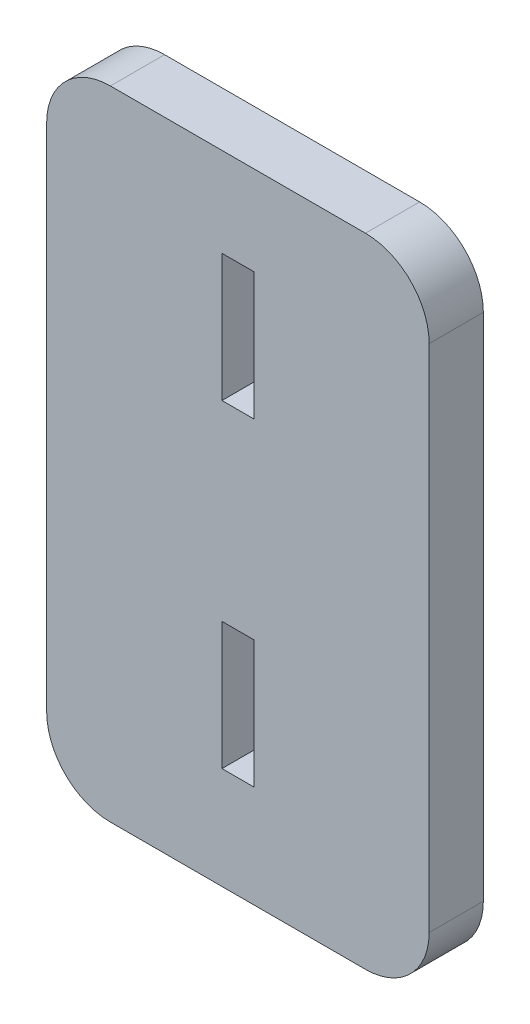
from build123d import *

# Parameters (mm, degrees)
CROQUIS2_W              = 60
CROQUIS2_H              = 100
SALIENTE_EXTRUIR1_DEPTH = 8.5
CROQUIS4_W              = 5
CROQUIS4_H              = 20
CORTAR_EXTRUIR1_DEPTH   = 7.48
REDONDEO1_R             = 10
REDONDEO2_R             = 10


with BuildPart() as part:
    # Croquis2 → Saliente-Extruir1 (new body)
    with BuildSketch(Plane.XY):
        Rectangle(CROQUIS2_W, CROQUIS2_H)
    extrude(amount=SALIENTE_EXTRUIR1_DEPTH)

    # Croquis4 → Cortar-Extruir1 (cut)
    with BuildSketch(Plane.XY.offset(8.5)):
        with Locations((0, 26.02)):
            Rectangle(CROQUIS4_W, CROQUIS4_H)
        with Locations((0, -23.98)):
            Rectangle(CROQUIS4_W, CROQUIS4_H)
    extrude(amount=-CORTAR_EXTRUIR1_DEPTH, mode=Mode.SUBTRACT)

    # Redondeo1
    redondeo1_edges = [part.edges().sort_by_distance(p)[0] for p in [
        (-30, 50, 4.25),
    ]]
    fillet(redondeo1_edges, radius=REDONDEO1_R)

    # Redondeo2
    redondeo2_edges = [part.edges().sort_by_distance(p)[0] for p in [
        (30, -50, 4.25),
        (-30, -50, 4.25),
        (30, 50, 4.25),
    ]]
    fillet(redondeo2_edges, radius=REDONDEO2_R)


solid = part.part
